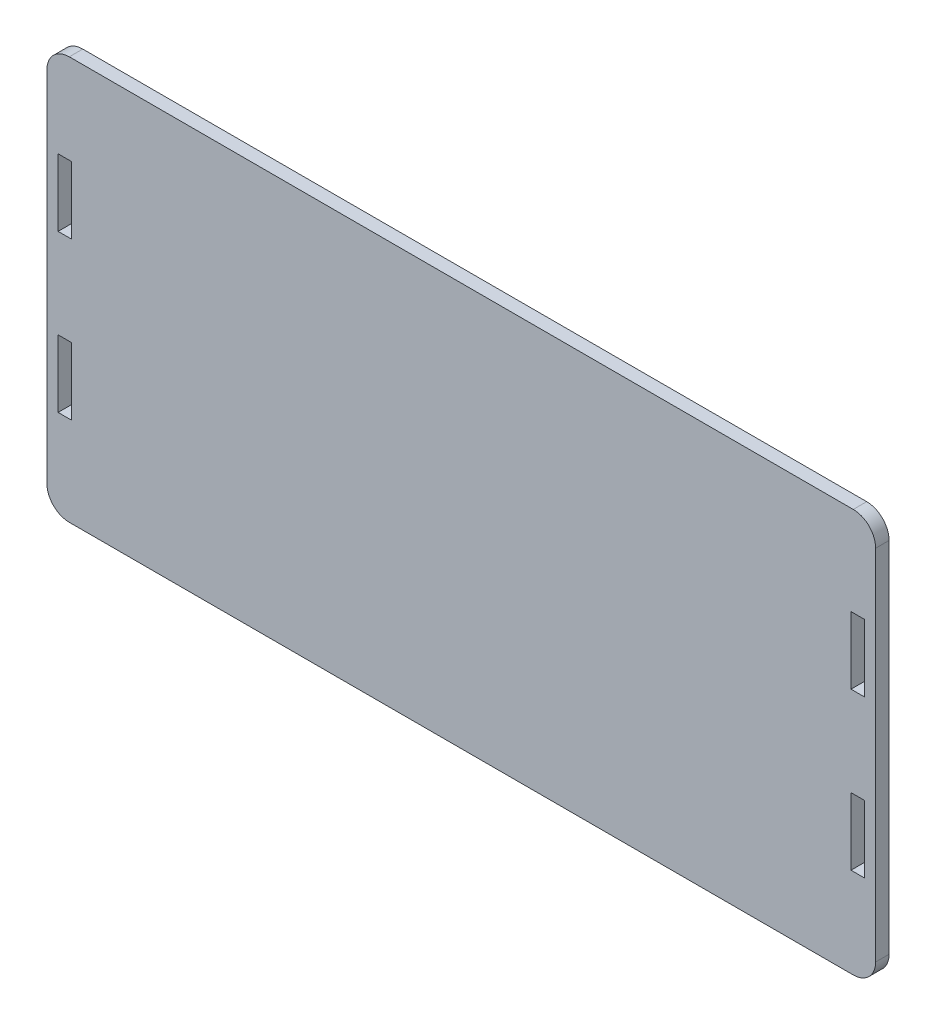
from build123d import *

# Parameters (mm, degrees)
ESQUISSE1_W             = 370
ESQUISSE1_H             = 180
BOSS_EXTRU_1_DEPTH      = 6
ESQUISSE2_W             = 6
ESQUISSE2_H             = 30
ENL_V_MAT_EXTRU_1_DEPTH = 10
CONG_1_R                = 10


with BuildPart() as part:
    # Esquisse1 → Boss.-Extru.1 (new body)
    with BuildSketch(Plane.XY):
        with Locations((185, 90)):
            Rectangle(ESQUISSE1_W, ESQUISSE1_H)
    extrude(amount=BOSS_EXTRU_1_DEPTH)

    # Esquisse2 → Enlèv. mat.-Extru.1 (cut)
    with BuildSketch(Plane.XY.offset(6)):
        with Locations((8, 55)):
            Rectangle(ESQUISSE2_W, ESQUISSE2_H)
        with Locations((8, 125)):
            Rectangle(ESQUISSE2_W, ESQUISSE2_H)
        with Locations((362, 125)):
            Rectangle(ESQUISSE2_W, ESQUISSE2_H)
        with Locations((362, 55)):
            Rectangle(ESQUISSE2_W, ESQUISSE2_H)
    extrude(amount=-ENL_V_MAT_EXTRU_1_DEPTH, mode=Mode.SUBTRACT)

    # Congé1
    cong_1_edges = [part.edges().sort_by_distance(p)[0] for p in [
        (0, 180, 3),
        (370, 180, 3),
        (370, 0, 3),
        (0, 0, 3),
    ]]
    fillet(cong_1_edges, radius=CONG_1_R)


solid = part.part
